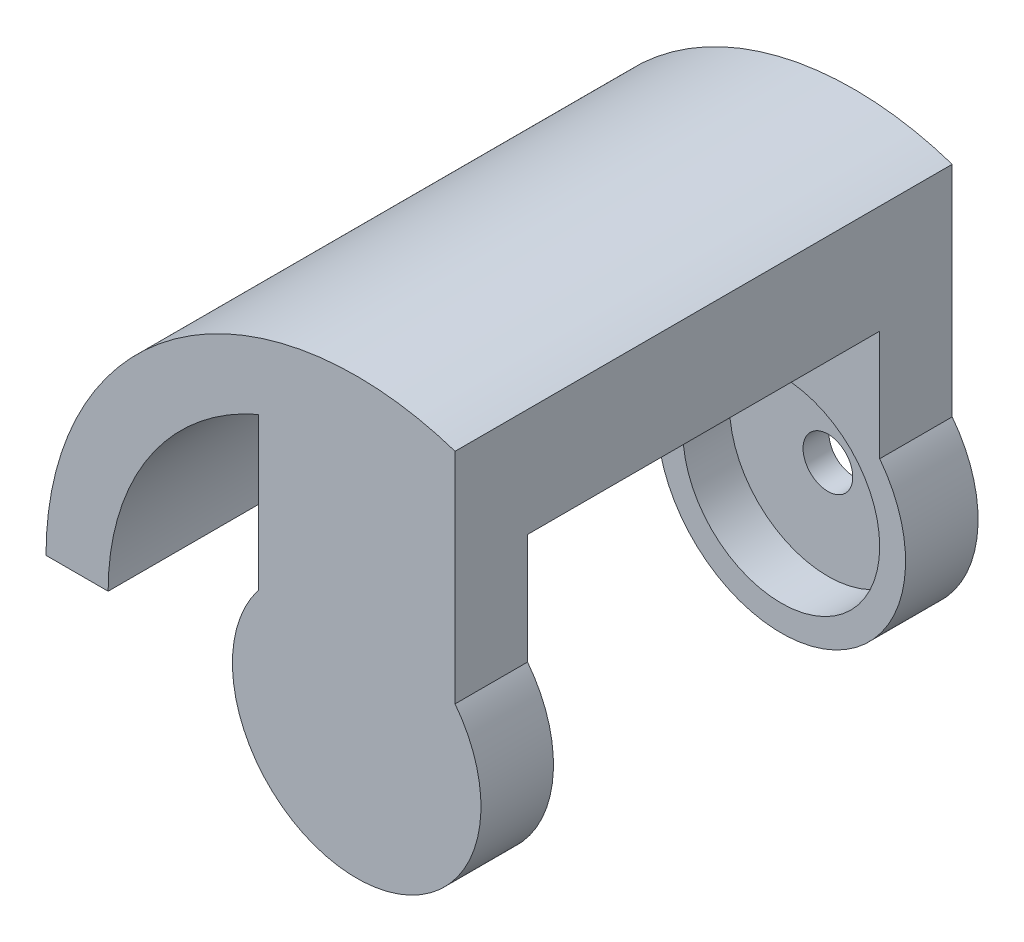
from build123d import *
from build123d.topology import SkipClean

# Parameters (mm, degrees)
SKETCH1_R           = 9.5
BOSS_EXTRUDE1_DEPTH = 48
SKETCH2_W           = 34
SKETCH2_H           = 30
CUT_EXTRUDE1_DEPTH  = 62.481704596
BOSS_EXTRUDE2_START = -2.5
SKETCH3_R           = 9.5
SKETCH3_R_2         = 2.4
BOSS_EXTRUDE2_DEPTH = 2.5
SKETCH4_R           = 9.5
SKETCH4_R_2         = 4.2
BOSS_EXTRUDE3_DEPTH = 7
SKETCH5_R           = 4.2
BOSS_EXTRUDE4_DEPTH = 11
CUT_EXTRUDE2_DEPTH  = 58.861904566
BOSS_EXTRUDE5_DEPTH = 48


with BuildPart() as part:
    # Sketch1 → Boss-Extrude1 (new body)
    with BuildSketch(Plane.XY):
        with BuildLine():
            Line((-12, 0), (-12, 30))
            Line((-12, 30), (12, 30))
            Line((12, 30), (12, 0))
            ThreePointArc((12, 0), (0, -12), (-12, 0))
        make_face()
        Circle(SKETCH1_R, mode=Mode.SUBTRACT)
    extrude(amount=-BOSS_EXTRUDE1_DEPTH)

    # Sketch2 → Cut-Extrude1 (cut, through all)
    with BuildSketch(Plane.ZY.offset(12)):
        with Locations((-24, 3)):
            Rectangle(SKETCH2_W, SKETCH2_H)
    extrude(amount=-CUT_EXTRUDE1_DEPTH, mode=Mode.SUBTRACT)

    # Sketch3 → Boss-Extrude2 (add)
    with BuildSketch(Plane(origin=(0, 0, -48), x_dir=(-1, 0, 0), z_dir=(0, 0, -1)).offset(BOSS_EXTRUDE2_START)):
        Circle(SKETCH3_R)
        Circle(SKETCH3_R_2, mode=Mode.SUBTRACT)
    extrude(amount=BOSS_EXTRUDE2_DEPTH)

    # Sketch4 → Boss-Extrude3 (add)
    with BuildSketch(Plane.XY):
        with Locations(Location((0, 0, 0), (0, 0, 180))):
            Circle(SKETCH4_R)
        Circle(SKETCH4_R_2, mode=Mode.SUBTRACT)
    extrude(amount=-BOSS_EXTRUDE3_DEPTH)

    # Sketch5 → Boss-Extrude4 (add)
    with BuildSketch(Plane.XY):
        Circle(SKETCH5_R)
    extrude(amount=-BOSS_EXTRUDE4_DEPTH)

    # Sketch6 → Cut-Extrude2 (cut, through all)
    with SkipClean():  # the faces are left unmerged after this step: merging them gives an invalid solid
        with BuildSketch(Plane(origin=(0, 0, -48), x_dir=(-1, 0, 0), z_dir=(0, 0, -1))):
            with BuildLine():
                Line((-12, 30), (-12, 27.49545417))
                ThreePointArc((-12, 27.49545417), (-10.760725498, 28.003692377), (-9.5, 28.45610655))
                Line((-9.5, 28.45610655), (-9.5, 30))
                Line((-9.5, 30), (-12, 30))
            make_face()
            with BuildLine():
                Line((-9.5, 30), (-9.5, 28.45610655))
                ThreePointArc((-9.5, 28.45610655), (-4.812317696, 29.611511248), (2.9e-08, 30))
                Line((2.9e-08, 30), (-9.5, 30))
            make_face()
            with BuildLine():
                ThreePointArc((2.9e-08, 30), (4.812317725, 29.611511243), (9.5, 28.45610655))
                Line((9.5, 28.45610655), (9.5, 30))
                Line((9.5, 30), (2.9e-08, 30))
            make_face()
            with BuildLine():
                Line((9.5, 30), (9.5, 28.45610655))
                ThreePointArc((9.5, 28.45610655), (10.760725498, 28.003692377), (12, 27.49545417))
                Line((12, 27.49545417), (12, 30))
                Line((12, 30), (9.5, 30))
            make_face()
            with BuildLine():
                Line((-12, 20.784609691), (-12, 0))
                ThreePointArc((-12, 0), (-11.357816692, 3.872983346), (-9.5, 7.331439149))
                Line((-9.5, 7.331439149), (-9.5, 22.039736841))
                ThreePointArc((-9.5, 22.039736841), (-10.768302375, 21.448628487), (-12, 20.784609691))
            make_face()
            with BuildLine():
                Line((-12, 27.49545417), (-12, 20.784609691))
                ThreePointArc((-12, 20.784609691), (-10.768302375, 21.448628487), (-9.5, 22.039736841))
                Line((-9.5, 22.039736841), (-9.5, 28.45610655))
                ThreePointArc((-9.5, 28.45610655), (-10.760725498, 28.003692377), (-12, 27.49545417))
            make_face()
            with BuildLine():
                Line((9.5, 22.039736841), (9.5, 9.5))
                Line((9.5, 9.5), (12, 12))
                Line((12, 12), (12, 20.784609691))
                ThreePointArc((12, 20.784609691), (10.768302375, 21.448628487), (9.5, 22.039736841))
            make_face()
            with BuildLine():
                ThreePointArc((9.5, 7.331439149), (11.357816692, 3.872983346), (12, 0))
                Line((12, 0), (12, 12))
                Line((12, 12), (9.5, 9.5))
                Line((9.5, 9.5), (9.5, 7.331439149))
            make_face()
        extrude(amount=-CUT_EXTRUDE2_DEPTH, mode=Mode.SUBTRACT)

    # Sketch7 → Boss-Extrude5 (add)
    with SkipClean():  # the faces are left unmerged after this step: merging them gives an invalid solid
        with BuildSketch(Plane(origin=(0, 0, -48), x_dir=(-1, 0, 0), z_dir=(0, 0, -1))):
            with BuildLine():
                ThreePointArc((12, 20.784609691), (14.610274296, 19.040480167), (16.970562748, 16.970562748))
                Line((16.970562748, 16.970562748), (21.213203436, 21.213203436))
                ThreePointArc((21.213203436, 21.213203436), (16.901061777, 24.786167732), (12, 27.49545417))
                Line((12, 27.49545417), (12, 20.784609691))
            make_face()
            with BuildLine():
                ThreePointArc((16.970562748, 16.970562748), (22.17310878, 9.184402377), (24, 0))
                Line((24, 0), (30, 0))
                ThreePointArc((30, 0), (27.716385975, 11.480502971), (21.213203436, 21.213203436))
                Line((21.213203436, 21.213203436), (16.970562748, 16.970562748))
            make_face()
        extrude(amount=-BOSS_EXTRUDE5_DEPTH)


solid = part.part
